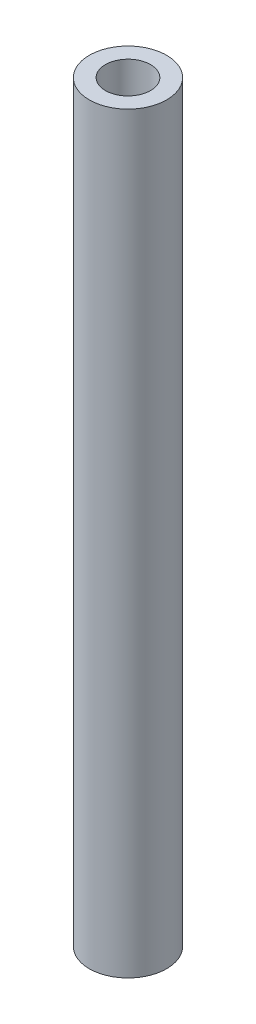
from build123d import *

# Parameters (mm, degrees)
SKETCH2_R           = 6.096
SKETCH2_R_2         = 3.556
BOSS_EXTRUDE1_DEPTH = 118.618


with BuildPart() as part:
    # Sketch2 → Boss-Extrude1 (new body)
    with BuildSketch(Plane(origin=(0, 0, 0), x_dir=(1, 0, 0), z_dir=(0, 1, 0))):
        with Locations(Location((0, 0, 0), (0, 0, 270))):
            Circle(SKETCH2_R)
        with Locations(Location((0, 0, 0), (0, 0, 270))):
            Circle(SKETCH2_R_2, mode=Mode.SUBTRACT)
    extrude(amount=BOSS_EXTRUDE1_DEPTH)


solid = part.part
